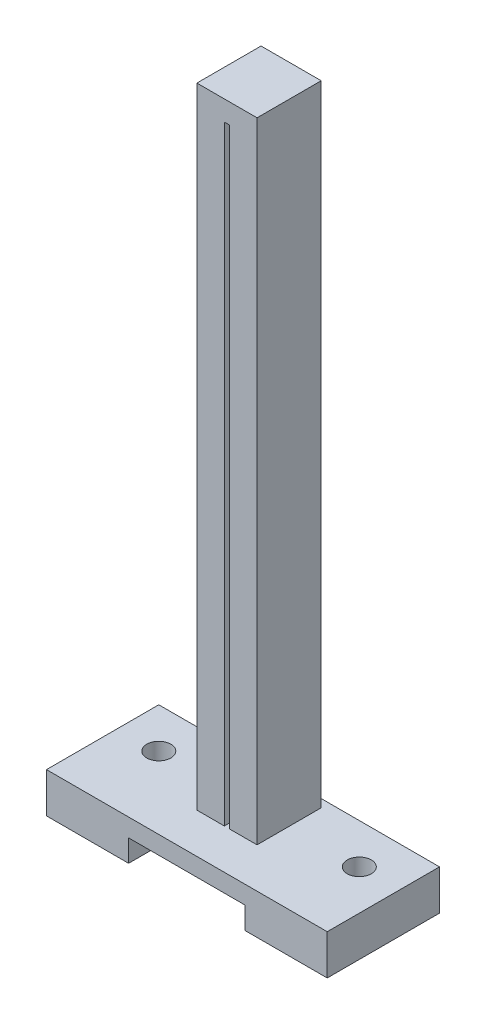
from build123d import *

# Parameters (mm, degrees)
SKETCH_1_W           = 70
SKETCH_1_H           = 43
EXTRUDE_1_DEPTH      = 10
SKETCH_21_R          = 3
CUT_EXTRUDE_12_DEPTH = 43.275879648
SKETCH_22_R          = 3
CUT_EXTRUDE_13_DEPTH = 43.275879648
SKETCH_46_W          = 15
SKETCH_46_H          = 12
EXTRUDE_4_DEPTH      = 200
SKETCH_76_W          = 7.65
SKETCH_76_H          = 200
CUT_EXTRUDE_37_DEPTH = 217.439367953
SKETCH_78_W          = 15
SKETCH_78_H          = 2
EXTRUDE_16_DEPTH     = 200
SKETCH_79_W          = 15
SKETCH_79_H          = 2
EXTRUDE_17_DEPTH     = 200
SKETCH_80_W          = 1.3
SKETCH_80_H          = 200
CUT_EXTRUDE_38_DEPTH = 215.359511102
SKETCH_83_W          = 7.65
SKETCH_83_H          = 12
CUT_EXTRUDE_39_DEPTH = 205.174557671
SKETCH_84_W          = 10
SKETCH_84_H          = 11
CUT_EXTRUDE_40_DEPTH = 218.195764231
SKETCH_82_W          = 15
SKETCH_82_H          = 16
EXTRUDE_19_DEPTH     = 10
SKETCH_85_W          = 70
SKETCH_85_H          = 15
CUT_EXTRUDE_41_DEPTH = 10
SKETCH_86_W          = 15
SKETCH_86_H          = 35
CUT_EXTRUDE_42_DEPTH = 25
SKETCH_87_W          = 15
SKETCH_87_H          = 16
EXTRUDE_20_DEPTH     = 5
SKETCH_88_W          = 15
SKETCH_88_H          = 28
CUT_EXTRUDE_43_DEPTH = 35
SKETCH_89_W          = 15
SKETCH_89_H          = 16
EXTRUDE_21_DEPTH     = 5
SKETCH_90_W          = 29.045295042
SKETCH_90_H          = 11
CUT_EXTRUDE_44_DEPTH = 20


with BuildPart() as part:
    # 草圖1 → 填料-伸長1 (new body)
    with BuildSketch(Plane(origin=(0, 0, 0), x_dir=(1, 0, 0), z_dir=(0, 1, 0))):
        Rectangle(SKETCH_1_W, SKETCH_1_H)
    extrude(amount=EXTRUDE_1_DEPTH)

    # 草圖21 → 除料-伸長12 (cut, through all)
    with BuildSketch(Plane(origin=(0, 10, 0), x_dir=(1, 0, 0), z_dir=(0, 1, 0))):
        with Locations(Location((-25, 11.5, 0), (0, 0, 270))):
            Circle(SKETCH_21_R)
    extrude(amount=-CUT_EXTRUDE_12_DEPTH, mode=Mode.SUBTRACT)

    # 草圖22 → 除料-伸長13 (cut, through all)
    with BuildSketch(Plane(origin=(0, 10, 0), x_dir=(1, 0, 0), z_dir=(0, 1, 0))):
        with Locations(Location((25, 11.5, 0), (0, 0, 270))):
            Circle(SKETCH_22_R)
    extrude(amount=-CUT_EXTRUDE_13_DEPTH, mode=Mode.SUBTRACT)

    # 草圖46 → 填料-伸長4 (add)
    with BuildSketch(Plane(origin=(0, 10, 0), x_dir=(1, 0, 0), z_dir=(0, 1, 0))):
        with Locations((0, 11.5)):
            Rectangle(SKETCH_46_W, SKETCH_46_H)
    extrude(amount=EXTRUDE_4_DEPTH)

    # 草圖76 → 除料-伸長37 (cut, through all)
    with BuildSketch(Plane(origin=(0, 0, -17.5), x_dir=(-1, 0, 0), z_dir=(0, 0, -1))):
        with Locations((0, 110)):
            Rectangle(SKETCH_76_W, SKETCH_76_H)
    extrude(amount=-CUT_EXTRUDE_37_DEPTH, mode=Mode.SUBTRACT)

    # 草圖78 → 填料-伸長16 (add)
    with BuildSketch(Plane(origin=(0, 10, 0), x_dir=(1, 0, 0), z_dir=(0, 1, 0))):
        with Locations((0, 4.5)):
            Rectangle(SKETCH_78_W, SKETCH_78_H)
    extrude(amount=EXTRUDE_16_DEPTH)

    # 草圖79 → 填料-伸長17 (add)
    with BuildSketch(Plane(origin=(0, 10, 0), x_dir=(1, 0, 0), z_dir=(0, 1, 0))):
        with Locations((0, 18.5)):
            Rectangle(SKETCH_79_W, SKETCH_79_H)
    extrude(amount=EXTRUDE_17_DEPTH)

    # 草圖80 → 除料-伸長38 (cut, through all)
    with BuildSketch(Plane.XY.offset(-3.5)):
        with Locations((0, 110)):
            Rectangle(SKETCH_80_W, SKETCH_80_H)
    extrude(amount=-CUT_EXTRUDE_38_DEPTH, mode=Mode.SUBTRACT)

    # 草圖83 → 除料-伸長39 (cut, through all)
    with BuildSketch(Plane(origin=(0, 10, 0), x_dir=(1, 0, 0), z_dir=(0, 1, 0))):
        with Locations((0, 11.5)):
            Rectangle(SKETCH_83_W, SKETCH_83_H)
    extrude(amount=-CUT_EXTRUDE_39_DEPTH, mode=Mode.SUBTRACT)

    # 草圖84 → 除料-伸長40 (cut, through all)
    with BuildSketch(Plane(origin=(0, 0, -21.5), x_dir=(-1, 0, 0), z_dir=(0, 0, -1))):
        Rectangle(SKETCH_84_W, SKETCH_84_H)
    extrude(amount=-CUT_EXTRUDE_40_DEPTH, mode=Mode.SUBTRACT)

    # 草圖82 → 填料-伸長19 (add)
    with BuildSketch(Plane(origin=(0, 210, 0), x_dir=(1, 0, 0), z_dir=(0, 1, 0))):
        with Locations((0, 11.5)):
            Rectangle(SKETCH_82_W, SKETCH_82_H)
    extrude(amount=EXTRUDE_19_DEPTH)

    # 草圖85 → 除料-伸長41 (cut)
    with BuildSketch(Plane(origin=(0, 10, 0), x_dir=(1, 0, 0), z_dir=(0, 1, 0))):
        with Locations((0, -14)):
            Rectangle(SKETCH_85_W, SKETCH_85_H)
    extrude(amount=-CUT_EXTRUDE_41_DEPTH, mode=Mode.SUBTRACT)

    # 草圖86 → 除料-伸長42 (cut)
    with BuildSketch(Plane.XY.offset(-3.5)):
        with Locations((0, 202.5)):
            Rectangle(SKETCH_86_W, SKETCH_86_H)
    extrude(amount=-CUT_EXTRUDE_42_DEPTH, mode=Mode.SUBTRACT)

    # 草圖87 → 填料-伸長20 (add)
    with BuildSketch(Plane(origin=(0, 185, 0), x_dir=(1, 0, 0), z_dir=(0, 1, 0))):
        with Locations((0, 11.5)):
            Rectangle(SKETCH_87_W, SKETCH_87_H)
    extrude(amount=EXTRUDE_20_DEPTH)

    # 草圖88 → 除料-伸長43 (cut)
    with BuildSketch(Plane(origin=(0, 0, -19.5), x_dir=(-1, 0, 0), z_dir=(0, 0, -1))):
        with Locations((0, 176)):
            Rectangle(SKETCH_88_W, SKETCH_88_H)
    extrude(amount=-CUT_EXTRUDE_43_DEPTH, mode=Mode.SUBTRACT)

    # 草圖89 → 填料-伸長21 (add)
    with BuildSketch(Plane(origin=(0, 162, 0), x_dir=(1, 0, 0), z_dir=(0, 1, 0))):
        with Locations((0, 11.5)):
            Rectangle(SKETCH_89_W, SKETCH_89_H)
    extrude(amount=EXTRUDE_21_DEPTH)

    # 草圖90 → 除料-伸長44 (cut)
    with BuildSketch(Plane.XY.offset(6.5)):
        Rectangle(SKETCH_90_W, SKETCH_90_H)
    extrude(amount=-CUT_EXTRUDE_44_DEPTH, mode=Mode.SUBTRACT)


solid = part.part
